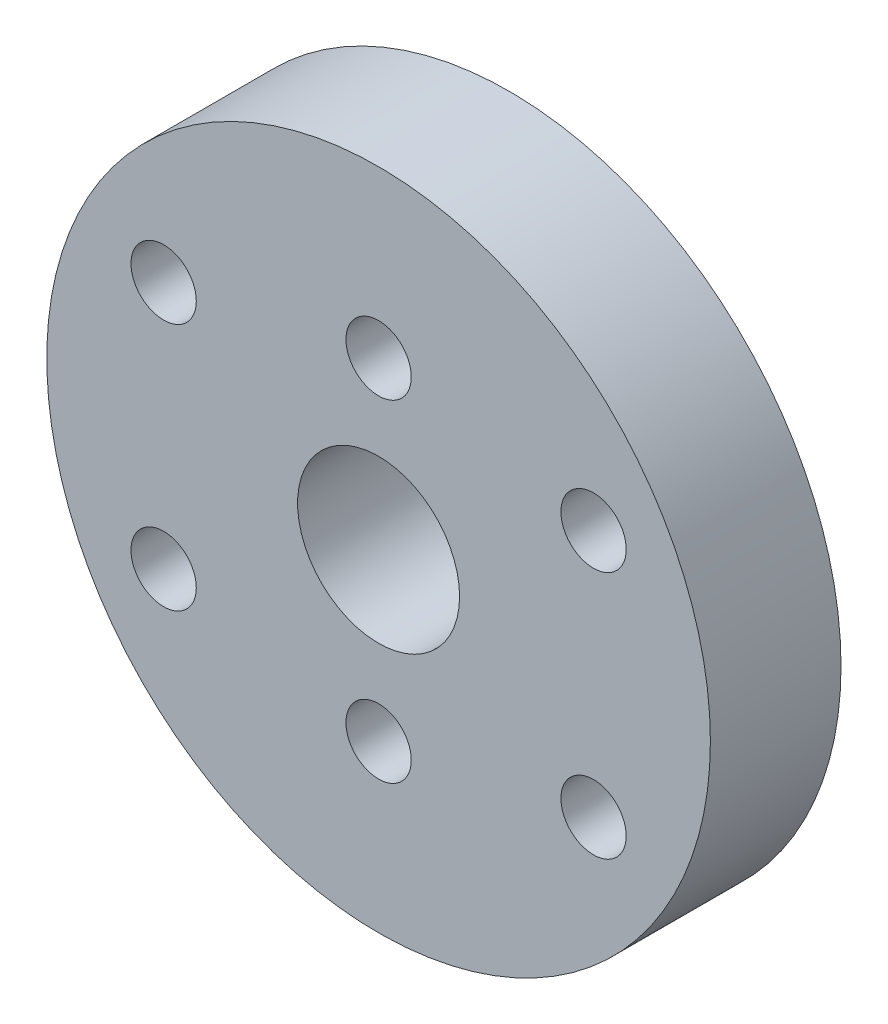
from build123d import *

# Parameters (mm, degrees)
ESQUISSE1_R        = 12.7
ESQUISSE1_R_2      = 1.25
ESQUISSE1_R_3      = 3.1
BOSS_EXTRU_1_DEPTH = 5


with BuildPart() as part:
    # Esquisse1 → Boss.-Extru.1 (new body)
    with BuildSketch(Plane.XY):
        Circle(ESQUISSE1_R)
        with Locations((0, 6.35)):
            Circle(ESQUISSE1_R_2, mode=Mode.SUBTRACT)
        with Locations((8.227241336, 4.75)):
            Circle(ESQUISSE1_R_2, mode=Mode.SUBTRACT)
        with Locations((8.227241336, -4.75)):
            Circle(ESQUISSE1_R_2, mode=Mode.SUBTRACT)
        with Locations((0, -6.35)):
            Circle(ESQUISSE1_R_2, mode=Mode.SUBTRACT)
        with Locations((-8.227241336, -4.75)):
            Circle(ESQUISSE1_R_2, mode=Mode.SUBTRACT)
        Circle(ESQUISSE1_R_3, mode=Mode.SUBTRACT)
        with Locations((-8.227241336, 4.75)):
            Circle(ESQUISSE1_R_2, mode=Mode.SUBTRACT)
    extrude(amount=BOSS_EXTRU_1_DEPTH)


solid = part.part
